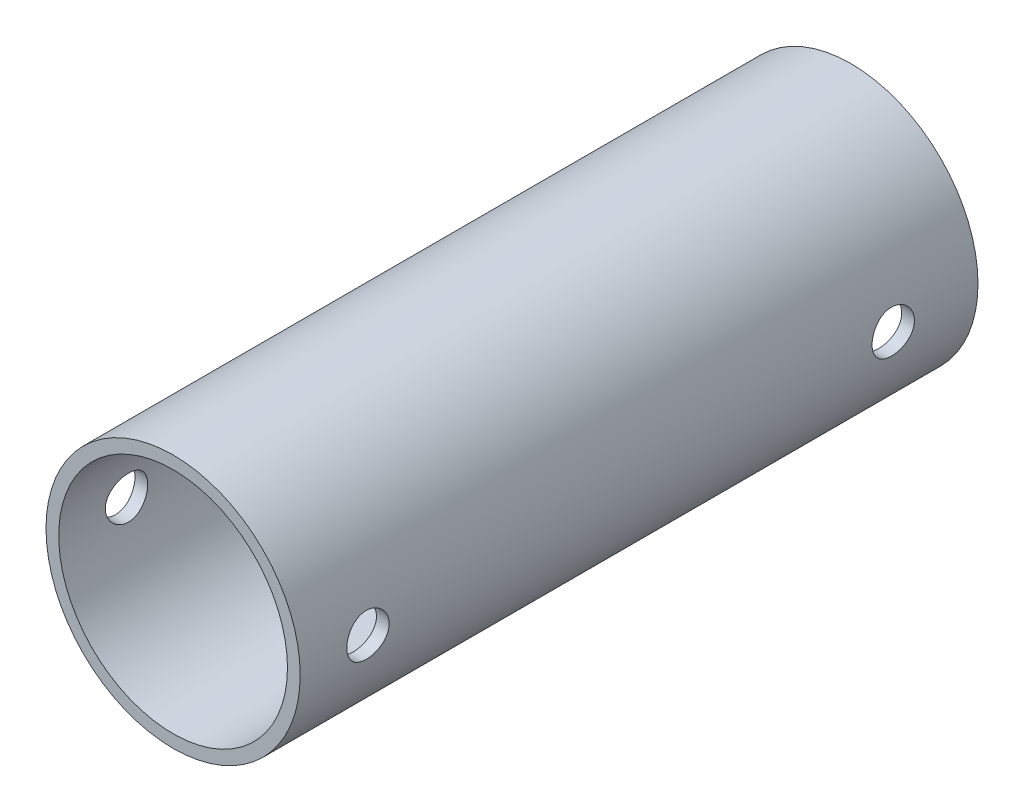
from build123d import *

# Parameters (mm, degrees)
SKETCH1_R           = 15
SKETCH1_R_2         = 13.5
BOSS_EXTRUDE1_DEPTH = 80
SKETCH2_R           = 2.5
CUT_EXTRUDE1_DEPTH  = 27


with BuildPart() as part:
    # Sketch1 → Boss-Extrude1 (new body)
    with BuildSketch(Plane.XY):
        Circle(SKETCH1_R)
        Circle(SKETCH1_R_2, mode=Mode.SUBTRACT)
    extrude(amount=BOSS_EXTRUDE1_DEPTH)

    # Sketch2 → Cut-Extrude1 (cut, symmetric)
    with BuildSketch(Plane(origin=(0, 0, 0), x_dir=(0, 0, -1), z_dir=(1, 0, 0))):
        with Locations((-10, 0)):
            Circle(SKETCH2_R)
        with Locations((-72, 0)):
            Circle(SKETCH2_R)
    extrude(amount=CUT_EXTRUDE1_DEPTH, both=True, mode=Mode.SUBTRACT)


solid = part.part
